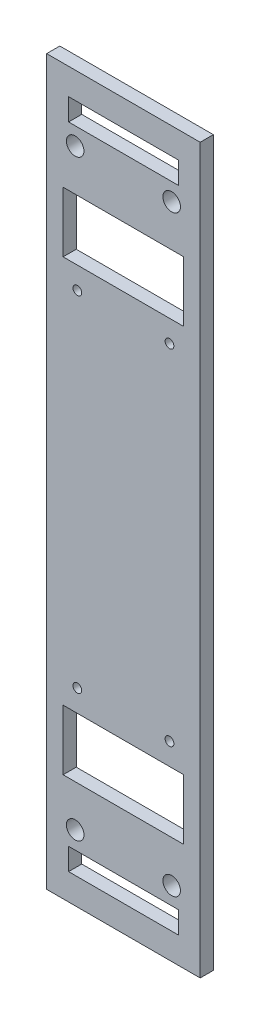
from build123d import *

# Parameters (mm, degrees)
ESQUISSE1_W             = 70
ESQUISSE1_H             = 330
BOSS_EXTRU_1_DEPTH      = 6
ESQUISSE2_R             = 2
ESQUISSE2_R_2           = 4
ESQUISSE2_W             = 55
ESQUISSE2_H             = 27.5
ESQUISSE2_W_2           = 50
ESQUISSE2_H_2           = 10
ENL_V_MAT_EXTRU_2_DEPTH = 169.777960647


with BuildPart() as part:
    # Esquisse1 → Boss.-Extru.1 (new body)
    with BuildSketch(Plane.XY):
        Rectangle(ESQUISSE1_W, ESQUISSE1_H)
    extrude(amount=BOSS_EXTRU_1_DEPTH)

    # Esquisse2 → Enlèv. mat.-Extru.2 (cut, through all)
    with BuildSketch(Plane.XY.offset(6)):
        with Locations((-21, 78.5)):
            Circle(ESQUISSE2_R)
        with Locations(Location((21, 78.5, 0), (0, 0, 180))):
            Circle(ESQUISSE2_R)
        with Locations((-22, 135)):
            Circle(ESQUISSE2_R_2)
        with Locations(Location((22, 135, 0), (0, 0, 180))):
            Circle(ESQUISSE2_R_2)
        with Locations(Location((-21, -78.5, 0), (0, 0, 90))):
            Circle(ESQUISSE2_R)
        with Locations(Location((21, -78.5, 0), (0, 0, 270))):
            Circle(ESQUISSE2_R)
        with Locations(Location((-22, -135, 0), (0, 0, 90))):
            Circle(ESQUISSE2_R_2)
        with Locations(Location((22, -135, 0), (0, 0, 270))):
            Circle(ESQUISSE2_R_2)
        with Locations((0, 102.25)):
            Rectangle(ESQUISSE2_W, ESQUISSE2_H)
        with Locations((0, 148)):
            Rectangle(ESQUISSE2_W_2, ESQUISSE2_H_2)
        with Locations((0, -102.25)):
            Rectangle(ESQUISSE2_W, ESQUISSE2_H)
        with Locations((0, -148)):
            Rectangle(ESQUISSE2_W_2, ESQUISSE2_H_2)
    extrude(amount=-ENL_V_MAT_EXTRU_2_DEPTH, mode=Mode.SUBTRACT)


solid = part.part
